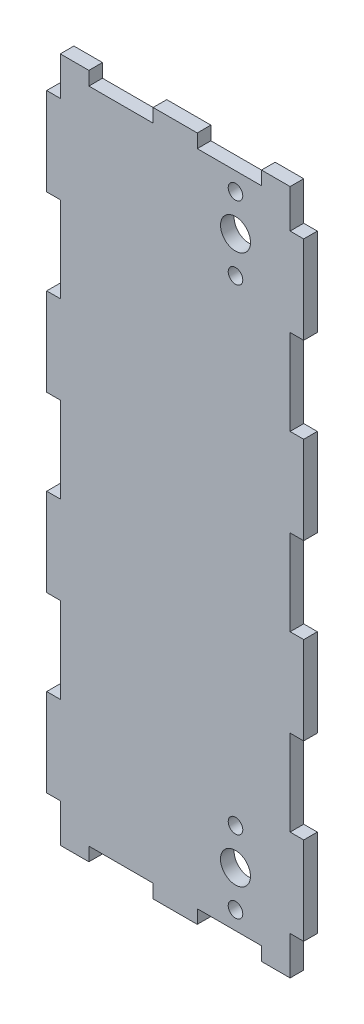
from build123d import *

# Parameters (mm, degrees)
SKETCH1_W           = 60
SKETCH1_H           = 160
BOSS_EXTRUDE1_DEPTH = 3.175
SKETCH4_W           = 3.175
SKETCH4_H           = 9
SKETCH4_H_2         = 20
SKETCH4_W_2         = 15
SKETCH4_H_3         = 3.175
CUT_EXTRUDE2_DEPTH  = 3.175
SKETCH5_R           = 3.5
SKETCH5_R_2         = 1.7
CUT_EXTRUDE3_DEPTH  = 3.175


with BuildPart() as part:
    # Sketch1 → Boss-Extrude1 (new body)
    with BuildSketch(Plane.XY):
        with Locations((-26.825, 54.431521206)):
            Rectangle(SKETCH1_W, SKETCH1_H)
    extrude(amount=-BOSS_EXTRUDE1_DEPTH)

    # Sketch4 → Cut-Extrude2 (cut)
    with BuildSketch(Plane.XY):
        with Locations((1.5875, -21.068478794)):
            Rectangle(SKETCH4_W, SKETCH4_H)
        with Locations((1.5875, 13.931521206)):
            Rectangle(SKETCH4_W, SKETCH4_H_2)
        with Locations((1.5875, 54.431521206)):
            Rectangle(SKETCH4_W, SKETCH4_H_2)
        with Locations((1.5875, 94.931521206)):
            Rectangle(SKETCH4_W, SKETCH4_H_2)
        with Locations((1.5875, 129.931521206)):
            Rectangle(SKETCH4_W, SKETCH4_H)
        with Locations((-39.475, -23.980978794)):
            Rectangle(SKETCH4_W_2, SKETCH4_H_3)
        with Locations((-55.2375, 13.931521206)):
            Rectangle(SKETCH4_W, SKETCH4_H_2)
        with Locations((-55.2375, 54.431521206)):
            Rectangle(SKETCH4_W, SKETCH4_H_2)
        with Locations((-55.2375, 94.931521206)):
            Rectangle(SKETCH4_W, SKETCH4_H_2)
        with Locations((-55.2375, 129.931521206)):
            Rectangle(SKETCH4_W, SKETCH4_H)
        with Locations((-55.2375, -21.068478794)):
            Rectangle(SKETCH4_W, SKETCH4_H)
        with Locations((-14.175, -23.980978794)):
            Rectangle(SKETCH4_W_2, SKETCH4_H_3)
        with Locations((-14.175, 132.844021206)):
            Rectangle(SKETCH4_W_2, SKETCH4_H_3)
        with Locations((-39.475, 132.844021206)):
            Rectangle(SKETCH4_W_2, SKETCH4_H_3)
    extrude(amount=-CUT_EXTRUDE2_DEPTH, mode=Mode.SUBTRACT)

    # Sketch5 → Cut-Extrude3 (cut)
    with BuildSketch(Plane.XY):
        with Locations((-12.75, -9.643478794)):
            Circle(SKETCH5_R)
        with Locations((-12.75, -18.143478794)):
            Circle(SKETCH5_R_2)
        with Locations(Location((-12.75, -1.143478794, 0), (0, 0, 180))):
            Circle(SKETCH5_R_2)
        with Locations(Location((-12.75, 127.006521206, 0), (0, 0, 180))):
            Circle(SKETCH5_R_2)
        with Locations(Location((-12.75, 118.506521206, 0), (0, 0, 180))):
            Circle(SKETCH5_R)
        with Locations((-12.75, 110.006521206)):
            Circle(SKETCH5_R_2)
    extrude(amount=-CUT_EXTRUDE3_DEPTH, mode=Mode.SUBTRACT)


solid = part.part
